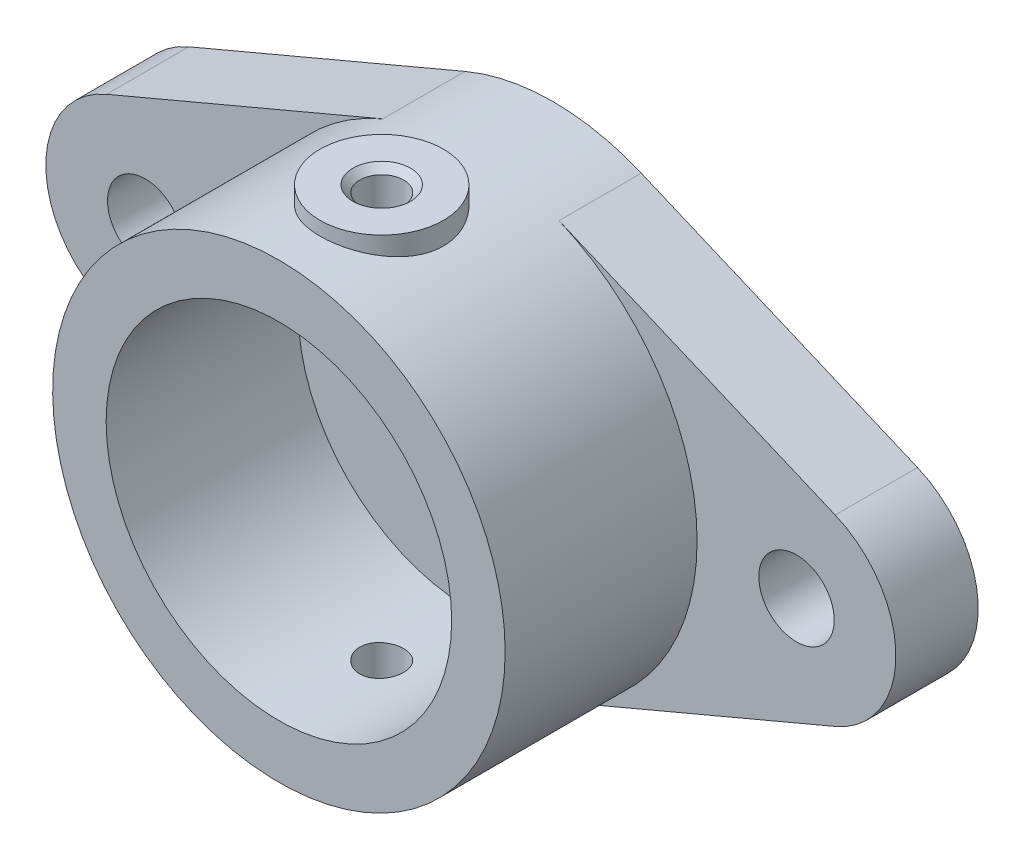
from build123d import *

# Parameters (mm, degrees)
SKETCH1_R                = 16.5
SKETCH1_R_2              = 12.6
BOSS_EXTRUDE1_DEPTH      = 15
BOSS_EXTRUDE2_START      = 5
SKETCH2_R                = 16.5
BOSS_EXTRUDE2_DEPTH      = 5
BOSS_EXTRUDE3_REACH      = 42.66
BOSS_EXTRUDE3_END_RADIUS = 16.5
SKETCH3_R                = 4.5
CUT_EXTRUDE1_REACH       = 42.66
CUT_EXTRUDE1_END_RADIUS  = 12.6
SKETCH4_R                = 1.6
CIRPATTERN1_COUNT        = 2
CHAMFER1_SIZE            = 0.5
SKETCH5_R                = 2.75
BOSS_EXTRUDE4_DEPTH      = 6


with BuildPart() as part:
    # Sketch1 → Boss-Extrude1 (new body)
    with BuildSketch(Plane.XY):
        Circle(SKETCH1_R)
        Circle(SKETCH1_R_2, mode=Mode.SUBTRACT)
    extrude(amount=BOSS_EXTRUDE1_DEPTH)

    # Sketch2 → Boss-Extrude2 (add)
    with BuildSketch(Plane(origin=(0, 0, 0), x_dir=(-1, 0, 0), z_dir=(0, 0, -1)).offset(BOSS_EXTRUDE2_START)):
        Circle(SKETCH2_R)
    extrude(amount=-BOSS_EXTRUDE2_DEPTH)

    # Boss-Extrude3: up to this cylinder (the profile starts outside it)
    boss_extrude3_end = Plane(origin=(0, 0, 7.5), z_dir=(0, 0, -1)) * Cylinder(BOSS_EXTRUDE3_END_RADIUS, 119.32, mode=Mode.PRIVATE)
    # Sketch3 → Boss-Extrude3 (add, up to the surface)
    with BuildSketch(Plane(origin=(0, 17.5, 0), x_dir=(1, 0, 0), z_dir=(0, 1, 0)), mode=Mode.PRIVATE) as boss_extrude3_sk1:
        with Locations(Location((0, -7.5, 0), (0, 0, 270))):
            Circle(SKETCH3_R)
    boss_extrude3_tool1 = extrude(boss_extrude3_sk1.sketch, amount=-BOSS_EXTRUDE3_REACH, mode=Mode.PRIVATE) - boss_extrude3_end
    boss_extrude3 = boss_extrude3_tool1.solids().sort_by_distance((0, 17.5, 7.5))[0]
    add(boss_extrude3)

    # Cut-Extrude1: up to this cylinder (the profile starts outside it)
    cut_extrude1_end = Plane(origin=(0, 0, 7.5), z_dir=(0, 0, -1)) * Cylinder(CUT_EXTRUDE1_END_RADIUS, 111.52, mode=Mode.PRIVATE)
    # Sketch4 → Cut-Extrude1 (cut, up to the surface)
    with BuildSketch(Plane(origin=(0, 17.5, 0), x_dir=(1, 0, 0), z_dir=(0, 1, 0)), mode=Mode.PRIVATE) as cut_extrude1_sk1:
        with Locations(Location((0, -7.5, 0), (0, 0, 270))):
            Circle(SKETCH4_R)
    cut_extrude1_tool1 = extrude(cut_extrude1_sk1.sketch, amount=-CUT_EXTRUDE1_REACH, mode=Mode.PRIVATE) - cut_extrude1_end
    cut_extrude1 = cut_extrude1_tool1.solids().sort_by_distance((0, 17.5, 7.5))[0]
    add(cut_extrude1, mode=Mode.SUBTRACT)

    # CirPattern1: Boss-Extrude3, Cut-Extrude1 ×2 about axis
    cirpattern1_axis = Axis((0, 0, 15), (0, 0, 1))
    add([boss_extrude3.rotate(cirpattern1_axis, i * 360 / CIRPATTERN1_COUNT) for i in range(1, CIRPATTERN1_COUNT)])
    add([cut_extrude1.rotate(cirpattern1_axis, i * 360 / CIRPATTERN1_COUNT) for i in range(1, CIRPATTERN1_COUNT)], mode=Mode.SUBTRACT)

    # Chamfer1
    chamfer1_edges = [part.edges().sort_by_distance(p)[0] for p in [
        (0, 17.5, 5.9),
        (0, -17.5, 5.9),
    ]]
    chamfer(chamfer1_edges, length=CHAMFER1_SIZE)

    # Sketch5 → Boss-Extrude4 (add)
    with BuildSketch(Plane(origin=(0, 0, -5), x_dir=(-1, 0, 0), z_dir=(0, 0, -1))):
        with BuildLine():
            Line((26.573684211, 6.677522556), (6.426315789, 15.197120299))
            ThreePointArc((6.426315789, 15.197120299), (0, 16.5), (-6.426315789, 15.197120299))
            Line((-6.426315789, 15.197120299), (-26.573684211, 6.677522556))
            ThreePointArc((-26.573684211, 6.677522556), (-31, 0), (-26.573684211, -6.677522556))
            Line((-26.573684211, -6.677522556), (-6.426315789, -15.197120299))
            ThreePointArc((-6.426315789, -15.197120299), (0, -16.5), (6.426315789, -15.197120299))
            Line((6.426315789, -15.197120299), (26.573684211, -6.677522556))
            ThreePointArc((26.573684211, -6.677522556), (31, 0), (26.573684211, 6.677522556))
        make_face()
        with Locations((23.75, 0)):
            Circle(SKETCH5_R, mode=Mode.SUBTRACT)
        with Locations((-23.75, 0)):
            Circle(SKETCH5_R, mode=Mode.SUBTRACT)
    extrude(amount=-BOSS_EXTRUDE4_DEPTH)


solid = part.part
